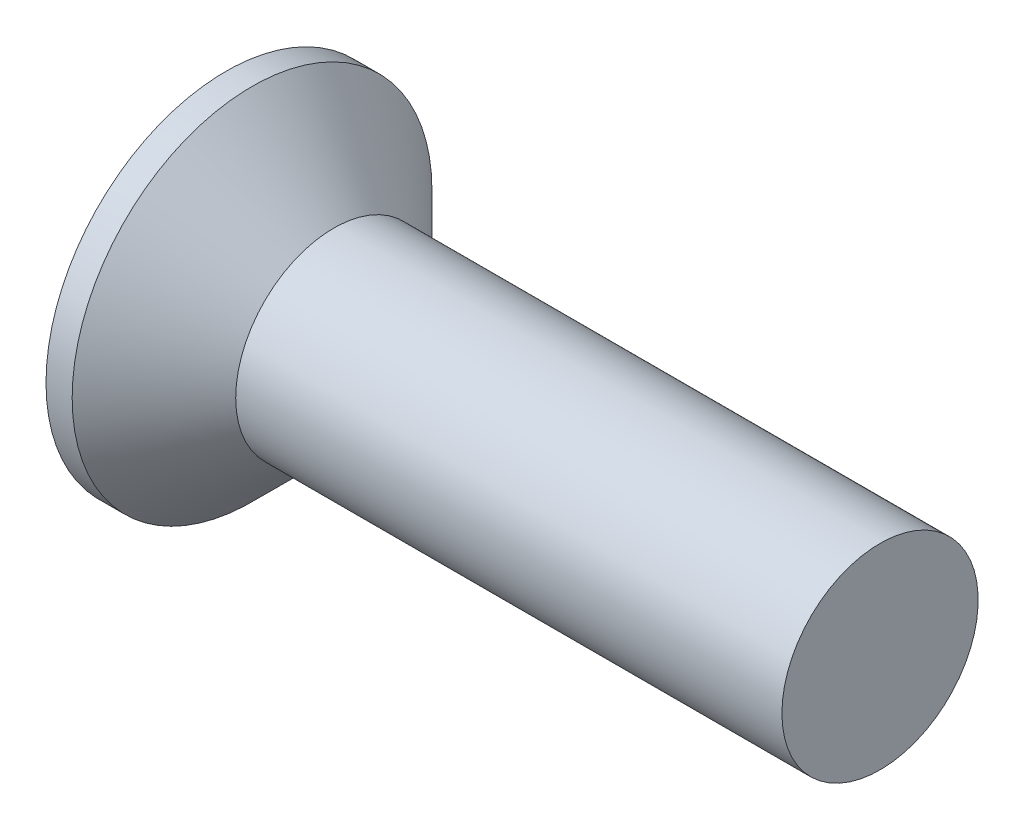
from build123d import *


with BuildPart() as part:
    # Esquisse1 → Révolution1 (revolve)
    with BuildSketch(Plane.XY, mode=Mode.PRIVATE) as r_volution1_sk:
        Polygon((0, 0), (10, 0), (10, 1.5), (1.65, 1.5), (0.4, 2.75), (0, 2.75), align=None)
    revolve(r_volution1_sk.sketch.rotate(Axis((0, 0, 0), (1, 0, 0)), 90), axis=Axis((0, 0, 0), (1, 0, 0)))


solid = part.part
